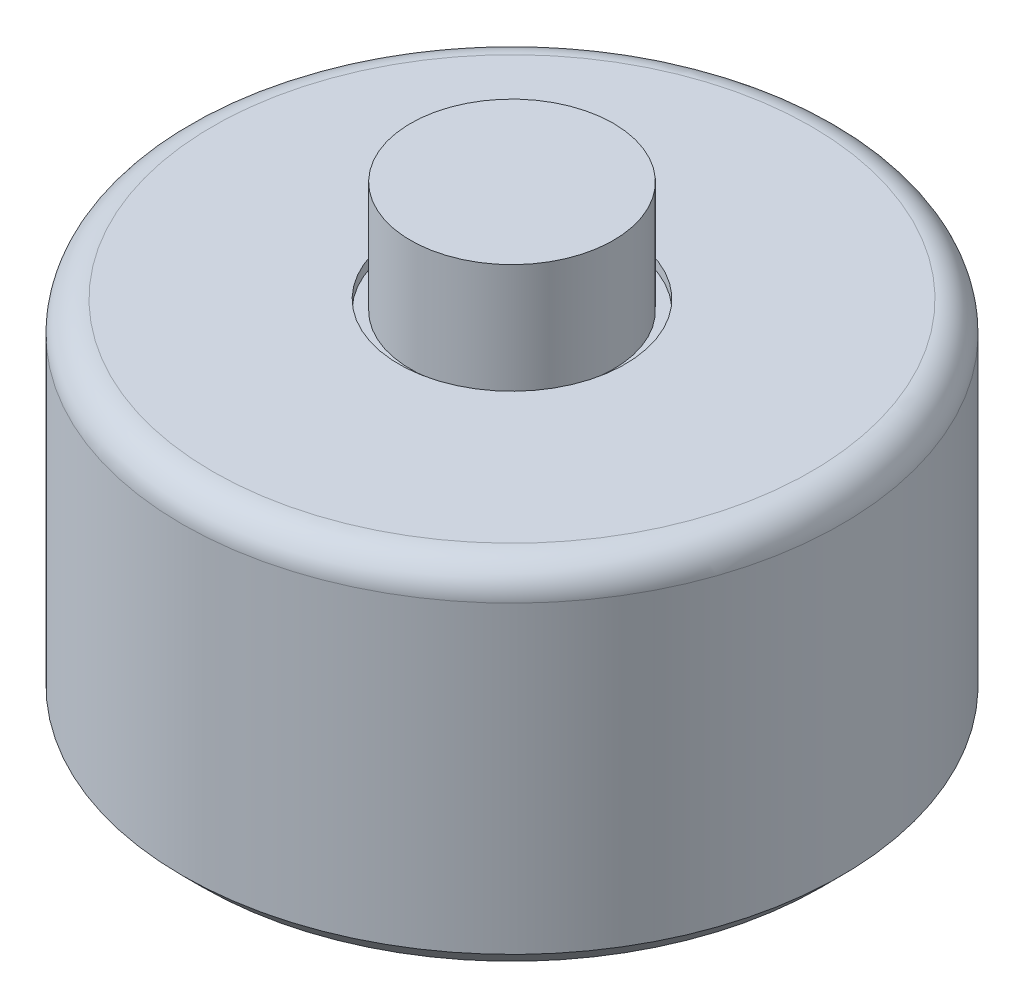
from build123d import *

# Parameters (mm, degrees)
FILLET1_R          = 0.762
CHAMFER1_SIZE      = 0.508
SKETCH2_W          = 1.905
SKETCH2_H          = 1.0795
CUT_EXTRUDE1_DEPTH = 0.5715
CIRPATTERN1_COUNT  = 4


with BuildPart() as part:
    # Sketch1 → Revolve1 (revolve)
    with BuildSketch(Plane.XY, mode=Mode.PRIVATE) as revolve1_sk:
        Polygon((0, 0), (0, 11.43), (2.54, 11.43), (2.54, 8.89), (2.54, 8.636), (2.8321, 8.636), (2.8321, 8.89), (8.255, 8.89), (8.255, 0), align=None)
    revolve(revolve1_sk.sketch.rotate(Axis((0, 0, 0), (0, 1, 0)), 90), axis=Axis((0, 0, 0), (0, 1, 0)))

    # Fillet1
    fillet1_edges = [part.edges().sort_by_distance(p)[0] for p in [
        (0, 8.89, 8.255),
    ]]
    fillet(fillet1_edges, radius=FILLET1_R)

    # Chamfer1
    chamfer1_edges = [part.edges().sort_by_distance(p)[0] for p in [
        (0, 0, 8.255),
    ]]
    chamfer(chamfer1_edges, length=CHAMFER1_SIZE)

    # Sketch2 → Cut-Extrude1 (cut)
    with BuildSketch(Plane.XZ):
        with Locations((5.7785, 0)):
            Rectangle(SKETCH2_W, SKETCH2_H)
    cut_extrude1 = extrude(amount=-CUT_EXTRUDE1_DEPTH, mode=Mode.SUBTRACT)

    # CirPattern1: Cut-Extrude1 ×4 about axis
    cirpattern1_axis = Axis((0, 0, 0), (0, 1, 0))
    for i in range(1, CIRPATTERN1_COUNT):
        add(cut_extrude1.rotate(cirpattern1_axis, i * 360 / CIRPATTERN1_COUNT), mode=Mode.SUBTRACT)


solid = part.part
